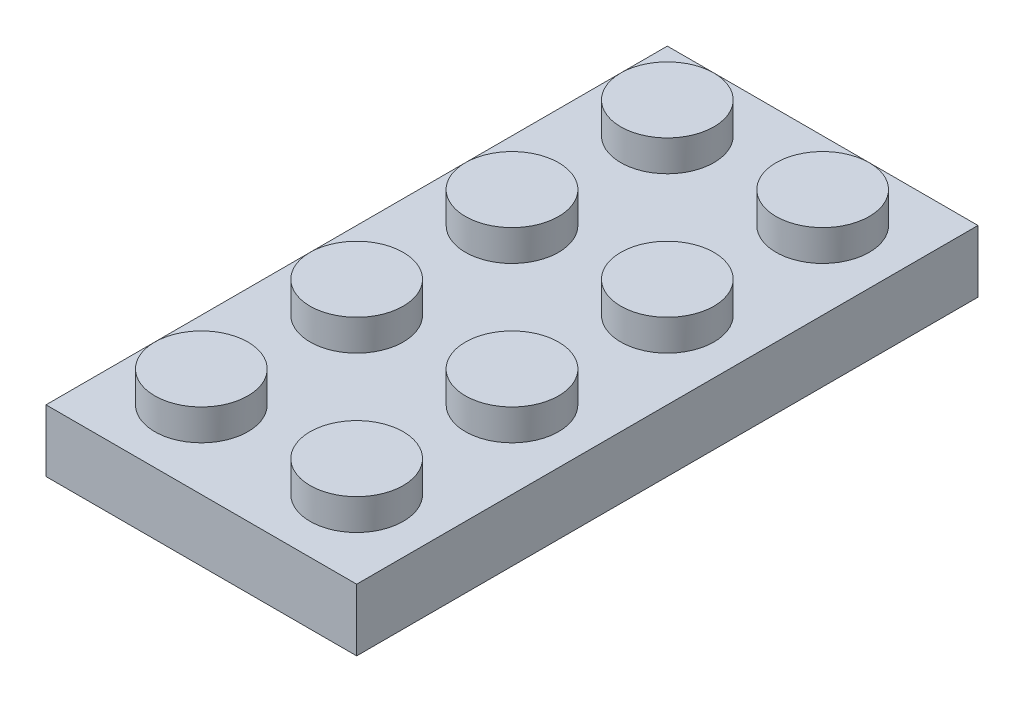
from build123d import *

# Parameters (mm, degrees)
SKETCH1_W            = 16
SKETCH1_H            = 32
BOSS_EXTRUDE1_DEPTH  = 3.2
SKETCH2_R            = 2.4
BOSS_EXTRUDE2_DEPTH  = 1.6
LPATTERN1_COUNT      = 2
LPATTERN1_PITCH      = 8
LPATTERN1_COUNT_DIR2 = 4
LPATTERN1_PITCH_DIR2 = 8
SHELL1_T             = -1.6


with BuildPart() as part:
    # Sketch1 → Boss-Extrude1 (new body)
    with BuildSketch(Plane(origin=(0, 0, 0), x_dir=(1, 0, 0), z_dir=(0, 1, 0))):
        with Locations((8, 16)):
            Rectangle(SKETCH1_W, SKETCH1_H)
    extrude(amount=BOSS_EXTRUDE1_DEPTH)

    # Sketch2 → Boss-Extrude2 (add)
    with BuildSketch(Plane(origin=(0, 3.2, 0), x_dir=(1, 0, 0), z_dir=(0, 1, 0))):
        with Locations(Location((12, 4, 0), (0, 0, 90))):
            Circle(SKETCH2_R)
    boss_extrude2 = extrude(amount=BOSS_EXTRUDE2_DEPTH)

    # LPattern1: Boss-Extrude2 2 × 4
    with Locations(*[(-i * LPATTERN1_PITCH, 0, -j * LPATTERN1_PITCH_DIR2) for i in range(LPATTERN1_COUNT) for j in range(LPATTERN1_COUNT_DIR2) if (i, j) != (0, 0)]):
        add(boss_extrude2)

    # Shell1
    shell1_openings = [part.faces().sort_by_distance(p)[0] for p in [
        (8, 0, -16),
    ]]
    offset(amount=SHELL1_T, openings=shell1_openings, kind=Kind.INTERSECTION)


solid = part.part
